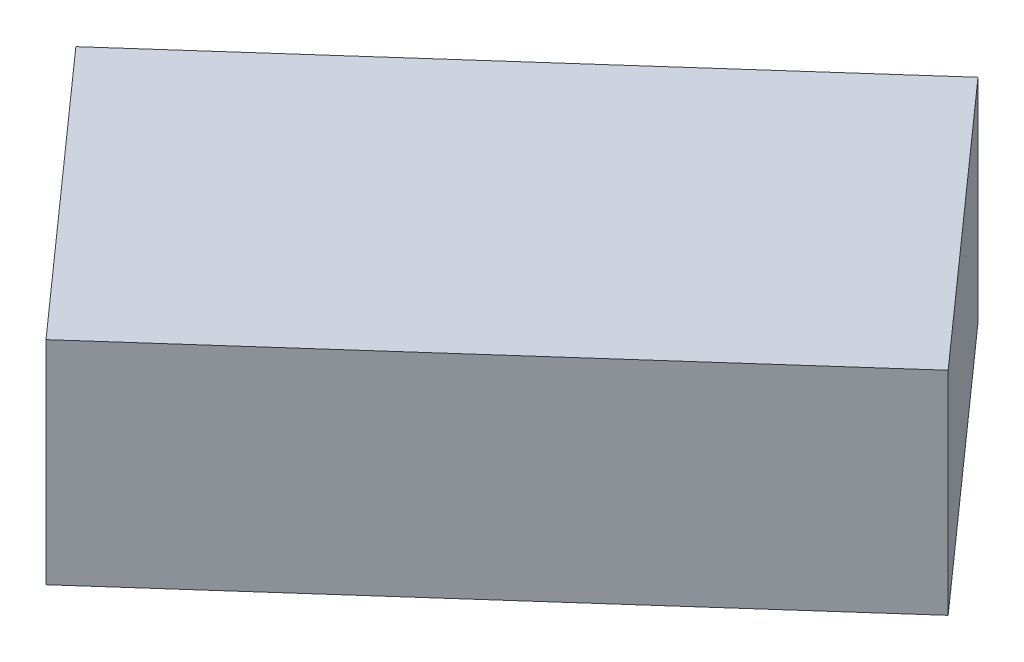
from build123d import *

# Parameters (mm, degrees)
EXTRUDE_START       = -4
EXTRUDE_1_DEPTH     = 8
SKETCH_2_R          = 3
SKETCH_2_R_2        = 1.5
CUT_EXTRUDE_1_DEPTH = 135.118611684


with BuildPart() as part:
    # 草图1 → 凸台-拉伸1 (new body)
    with BuildSketch(Plane(origin=(0, 0, 0), x_dir=(1, 0, 0), z_dir=(0, 1, 0)).offset(EXTRUDE_START)):
        Polygon((104.32, -54.86), (122.32, -38.86), (113.32, -28.735), (95.32, -44.735), align=None)
    extrude(amount=EXTRUDE_1_DEPTH)

    # 草图2 → 切除-拉伸1 (cut, through all)
    with BuildSketch(Plane(origin=(0, 0, 0), x_dir=(1, 0, 0), z_dir=(0, 1, 0))):
        with Locations((100, -50)):
            Circle(SKETCH_2_R)
        with Locations(Location((114, -38, 0), (0, 0, 270))):
            Circle(SKETCH_2_R_2)
    extrude(amount=-CUT_EXTRUDE_1_DEPTH, mode=Mode.SUBTRACT)


solid = part.part
